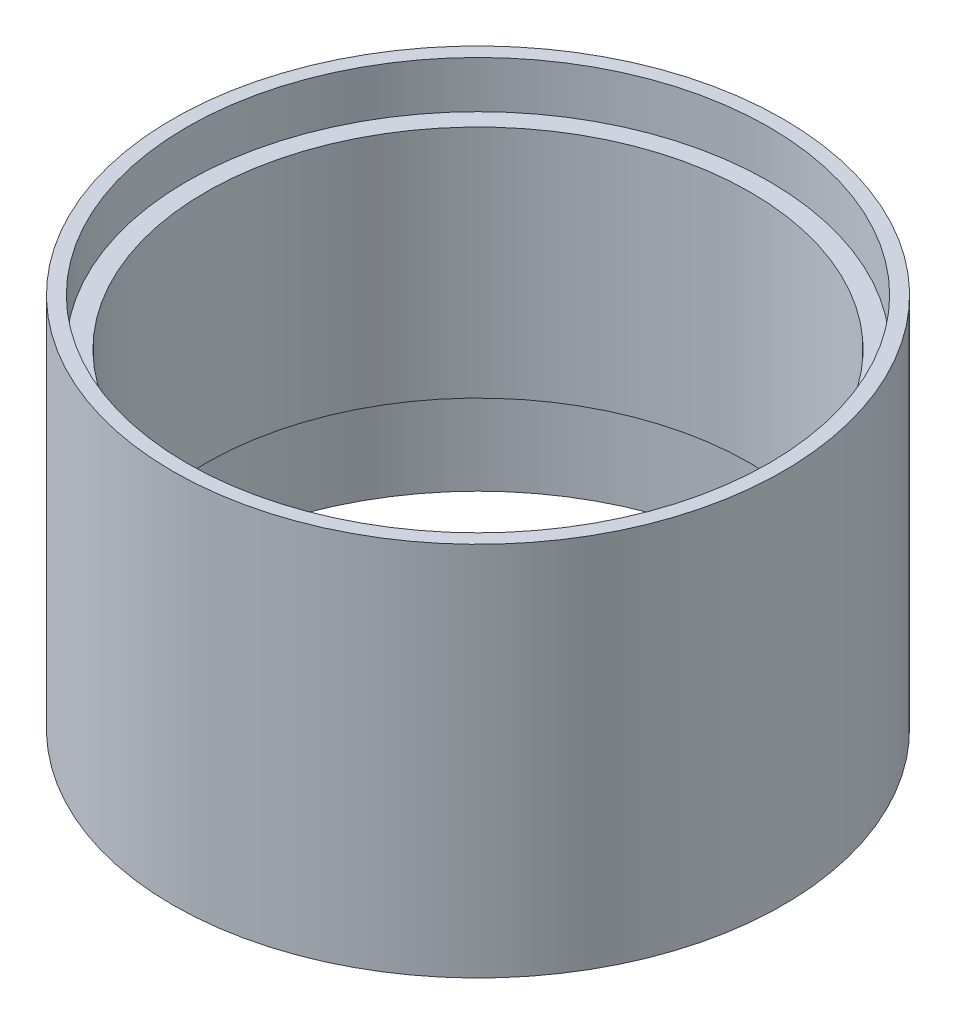
from build123d import *


with BuildPart() as part:
    # Szkic1 → Obrót1 (revolve)
    with BuildSketch(Plane.XY, mode=Mode.PRIVATE) as obr_t1_sk:
        Polygon((-65, 0), (-62, 0), (-62, 20), (-58, 20), (-58, 70), (-62, 70), (-62, 80), (-65, 80), (-65, 20), align=None)
    revolve(obr_t1_sk.sketch.rotate(Axis((0, 0, 0), (0, 1, 0)), 270), axis=Axis((0, 0, 0), (0, 1, 0)))


solid = part.part
